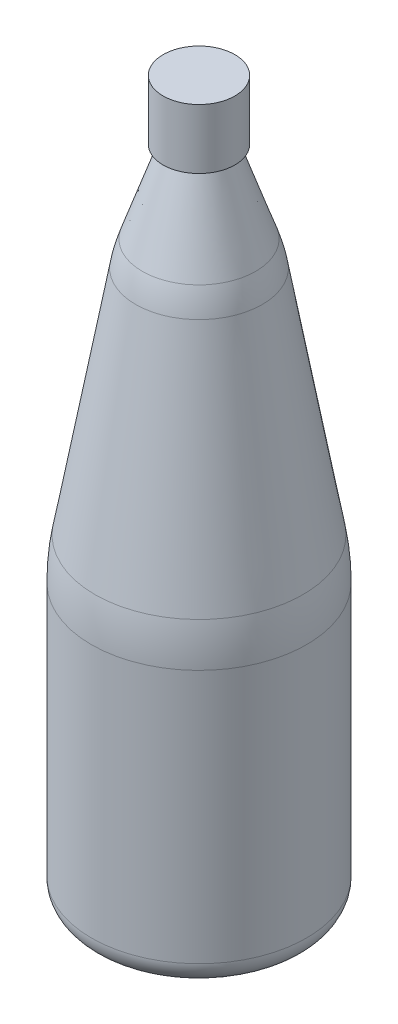
from build123d import *

# Parameters (mm, degrees)
SKETCH1_R           = 45
BOSS_EXTRUDE1_DEPTH = 275
FILLET1_R           = 10
CHAMFER1_SIZE       = 150
CHAMFER1_SIZE2      = 26.449047106
FILLET2_R           = 100
CHAMFER2_SIZE       = 40
CHAMFER2_SIZE2      = 6.617933019
FILLET3_R           = 70
SKETCH2_R           = 15
BOSS_EXTRUDE2_DEPTH = 25


with BuildPart() as part:
    # Sketch1 → Boss-Extrude1 (new body)
    with BuildSketch(Plane(origin=(0, 0, 0), x_dir=(1, 0, 0), z_dir=(0, 1, 0))):
        with Locations(Location((0, 0, 0), (0, 0, 270))):
            Circle(SKETCH1_R)
    extrude(amount=BOSS_EXTRUDE1_DEPTH)

    # Fillet1
    fillet1_edges = [part.edges().sort_by_distance(p)[0] for p in [
        (0, 0, -45),
    ]]
    fillet(fillet1_edges, radius=FILLET1_R)

    # Chamfer1
    chamfer1_edges = [part.edges().sort_by_distance(p)[0] for p in [
        (0, 275, -45),
    ]]
    chamfer1_side = [part.faces().sort_by_distance(p)[0] for p in [
        (0, 142.5, -45),
    ]]
    chamfer(chamfer1_edges, length=CHAMFER1_SIZE, length2=CHAMFER1_SIZE2, reference=chamfer1_side[0])

    # Fillet2
    fillet2_edges = [part.edges().sort_by_distance(p)[0] for p in [
        (0, 125, -45),
    ]]
    fillet(fillet2_edges, radius=FILLET2_R)

    # Chamfer2
    chamfer2_edges = [part.edges().sort_by_distance(p)[0] for p in [
        (0, 275, -18.550952894),
    ]]
    chamfer2_side = [part.faces().sort_by_distance(p)[0] for p in [
        (0, 204.307975707, -31.015864097),
    ]]
    chamfer(chamfer2_edges, length=CHAMFER2_SIZE, length2=CHAMFER2_SIZE2, reference=chamfer2_side[0])

    # Fillet3
    fillet3_edges = [part.edges().sort_by_distance(p)[0] for p in [
        (0, 235.60768988, -25.49688),
    ]]
    fillet(fillet3_edges, radius=FILLET3_R)

    # Sketch2 → Boss-Extrude2 (add)
    with BuildSketch(Plane(origin=(0, 275, 0), x_dir=(1, 0, 0), z_dir=(0, 1, 0))):
        with Locations(Location((0, 0, 0), (0, 0, 270))):
            Circle(SKETCH2_R)
    extrude(amount=BOSS_EXTRUDE2_DEPTH)


solid = part.part
